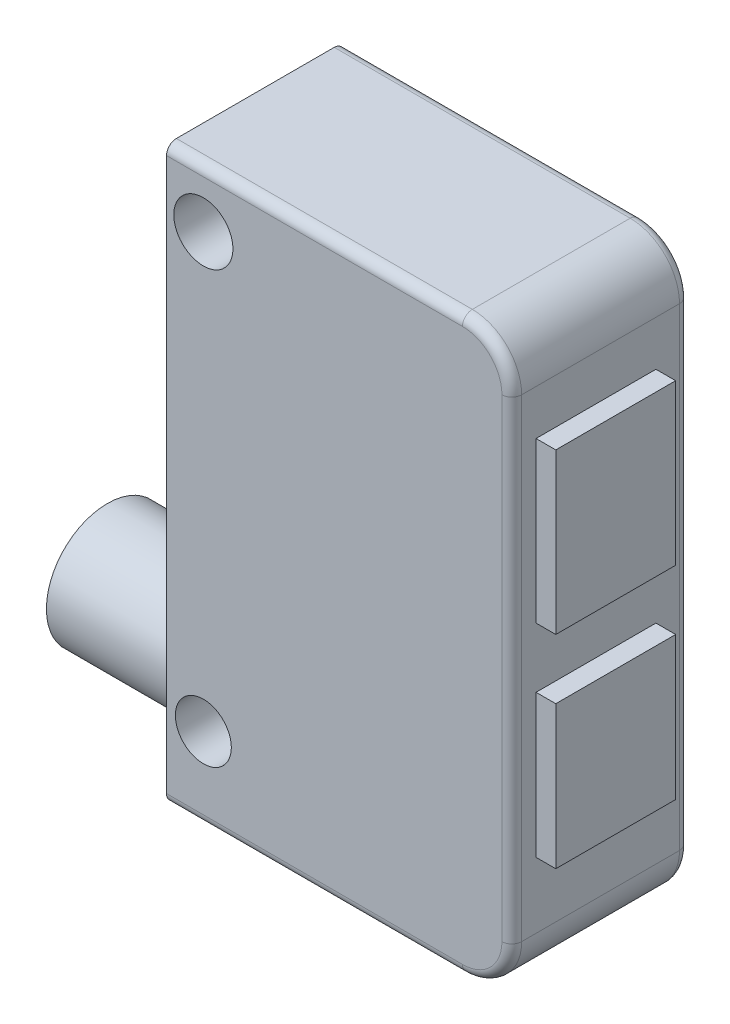
from build123d import *

# Parameters (mm, degrees)
CROQUIS1_W              = 35
CROQUIS1_H              = 58
SALIENTE_EXTRUIR1_DEPTH = 18
CROQUIS2_R              = 6.171851971
SALIENTE_EXTRUIR2_DEPTH = 16
REDONDEO1_R             = 5
REDONDEO2_R             = 1
CROQUIS3_R              = 2.99773064
CROQUIS3_R_2            = 2.835456682
CORTAR_EXTRUIR1_DEPTH   = 16
CROQUIS4_W              = 12.151773781
CROQUIS4_H              = 16.202365041
CROQUIS4_H_2            = 14.488653354
SALIENTE_EXTRUIR3_DEPTH = 2


with BuildPart() as part:
    # Croquis1 → Saliente-Extruir1 (new body)
    with BuildSketch(Plane.XY):
        Rectangle(CROQUIS1_W, CROQUIS1_H)
    extrude(amount=SALIENTE_EXTRUIR1_DEPTH)

    # Croquis2 → Saliente-Extruir2 (add)
    with BuildSketch(Plane.ZY.offset(17.5)):
        with Locations(Location((8, -21.714410647, 0), (0, 0, 90))):
            Circle(CROQUIS2_R)
    extrude(amount=SALIENTE_EXTRUIR2_DEPTH)

    # Redondeo1
    redondeo1_edges = [part.edges().sort_by_distance(p)[0] for p in [
        (17.5, -29, 9),
        (17.5, 29, 9),
    ]]
    fillet(redondeo1_edges, radius=REDONDEO1_R)

    # Redondeo2
    redondeo2_edges = [part.edges().sort_by_distance(p)[0] for p in [
        (-2.5, -29, 18),
        (17.5, 0, 0),
        (17.5, 0, 18),
        (-2.5, 29, 0),
        (16.035533906, 27.535533906, 0),
        (16.035533906, -27.535533906, 0),
        (-2.5, 29, 18),
        (16.035533906, 27.535533906, 18),
        (16.035533906, -27.535533906, 18),
        (-2.5, -29, 0),
    ]]
    fillet(redondeo2_edges, radius=REDONDEO2_R)

    # Croquis3 → Cortar-Extruir1 (cut)
    with BuildSketch(Plane.XY.offset(18)):
        with Locations((-13.764302947, 23.174055768)):
            Circle(CROQUIS3_R)
        with Locations((-13.764302947, -20.681384223)):
            Circle(CROQUIS3_R_2)
    extrude(amount=-CORTAR_EXTRUIR1_DEPTH, mode=Mode.SUBTRACT)

    # Croquis4 → Saliente-Extruir3 (add)
    with BuildSketch(Plane(origin=(17.5, 0, 0), x_dir=(0, 0, -1), z_dir=(1, 0, 0))):
        with Locations((-9.467375914, 11.333865931)):
            Rectangle(CROQUIS4_W, CROQUIS4_H)
        with Locations((-9.467375914, -10.087530158)):
            Rectangle(CROQUIS4_W, CROQUIS4_H_2)
    extrude(amount=SALIENTE_EXTRUIR3_DEPTH)


solid = part.part
